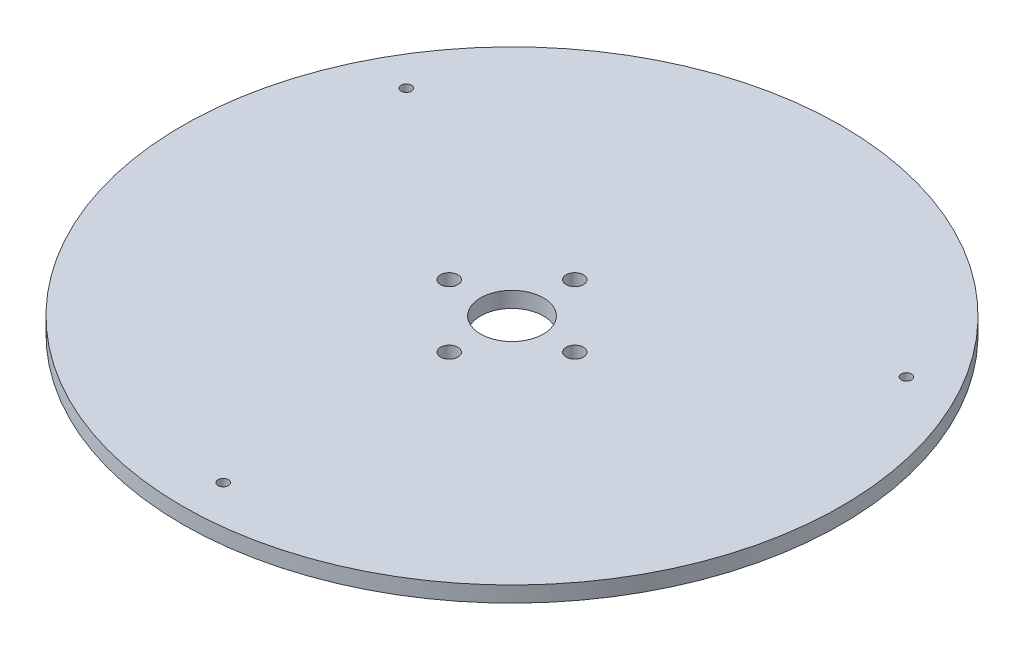
from build123d import *

# Parameters (mm, degrees)
ESQUISSE1_R                               = 105
ESQUISSE1_R_2                             = 10
BOSS_EXTRU_1_DEPTH                        = 5
TROU_POUR_TARAUDAGE_POUR_TROU_TARAUD_M4_D = 3.3
R_P_TITION_CIRCULAIRE1_COUNT              = 3
D_GAGEMENT_M51_D                          = 5.5
R_P_TITION_CIRCULAIRE2_COUNT              = 4


with BuildPart() as part:
    # Esquisse1 → Boss.-Extru.1 (new body)
    with BuildSketch(Plane(origin=(0, 0, 0), x_dir=(1, 0, 0), z_dir=(0, 1, 0))):
        Circle(ESQUISSE1_R)
        Circle(ESQUISSE1_R_2, mode=Mode.SUBTRACT)
    extrude(amount=BOSS_EXTRU_1_DEPTH)

    # Trou pour taraudage pour trou taraudé M41 (through all)
    with Locations(Plane(origin=(0, 5, 0), x_dir=(1, 0, 0), z_dir=(0, 1, 0))):
        with Locations((0, -92)):
            trou_pour_taraudage_pour_trou_taraud_m4 = Hole(TROU_POUR_TARAUDAGE_POUR_TROU_TARAUD_M4_D / 2)

    # Répétition circulaire1: Trou pour taraudage pour trou taraudé M41 ×3 about axis
    r_p_tition_circulaire1_axis = Axis((0, 5, 0), (0, -1, 0))
    for i in range(1, R_P_TITION_CIRCULAIRE1_COUNT):
        add(trou_pour_taraudage_pour_trou_taraud_m4.rotate(r_p_tition_circulaire1_axis, i * 360 / R_P_TITION_CIRCULAIRE1_COUNT), mode=Mode.SUBTRACT)

    # Dégagement M51 (through all)
    with Locations(Plane(origin=(0, 5, 0), x_dir=(1, 0, 0), z_dir=(0, 1, 0))):
        with Locations((0, -20)):
            d_gagement_m51 = Hole(D_GAGEMENT_M51_D / 2)

    # Répétition circulaire2: Dégagement M51 ×4 about axis
    r_p_tition_circulaire2_axis = Axis((0, 5, 0), (0, -1, 0))
    for i in range(1, R_P_TITION_CIRCULAIRE2_COUNT):
        add(d_gagement_m51.rotate(r_p_tition_circulaire2_axis, i * 360 / R_P_TITION_CIRCULAIRE2_COUNT), mode=Mode.SUBTRACT)


solid = part.part
